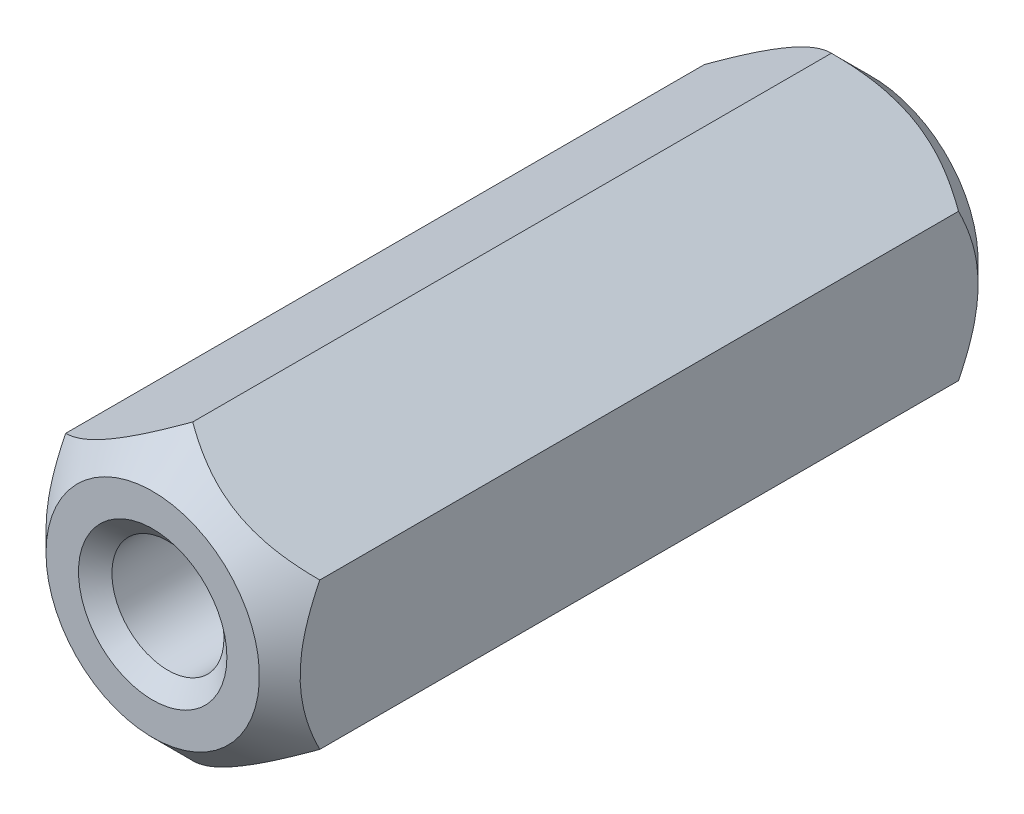
from build123d import *

# Parameters (mm, degrees)
BOSS_EXTRUDE1_DEPTH      = 8.98
BOSS_EXTRUDE1_DEPTH_BACK = 8.98


with BuildPart() as part:
    # Sketch1 → Boss-Extrude1 (new, two sides: drawn at the far end of the back side and taken through both)
    with BuildSketch(Plane.XY.offset(-BOSS_EXTRUDE1_DEPTH_BACK)):
        Polygon((3.175, -1.833087105), (3.175, 1.833087105), (0, 3.666174209), (-3.175, 1.833087105), (-3.175, -1.833087105), (0, -3.666174209), align=None)
    extrude(amount=BOSS_EXTRUDE1_DEPTH + BOSS_EXTRUDE1_DEPTH_BACK)

    # Sketch3 → Cut-Revolve2 (revolve, cut)
    with BuildSketch(Plane(origin=(0, 0, 0), x_dir=(0, 0, -1), z_dir=(1, 0, 0))):
        Polygon((-7.98, 3.666174209), (-8.98, 2.666174209), (-8.98, 3.666174209), align=None)
    cut_revolve2 = revolve(axis=Axis((0, 0, -0.635), (0, 0, 1)), mode=Mode.SUBTRACT)

    # Mirror1: Cut-Revolve2 across plane
    add(cut_revolve2.mirror(Plane.XY), mode=Mode.SUBTRACT)

    # Sketch4 → CSK for #1 Flat Head Machine Screw (100)1 (revolve, cut)
    with BuildSketch(Plane(origin=(0, 0, 8.98), x_dir=(0, -1, 0), z_dir=(1, 0, 0))):
        Polygon((0, 0), (0, 17.96), (1.6637, 17.96), (1.4, 17.6963), (1.4, 0.381119052), (1.8542, 0), align=None)
    revolve(axis=Axis((0, 0, 15.33), (0, 0, -1)), mode=Mode.SUBTRACT)


solid = part.part
